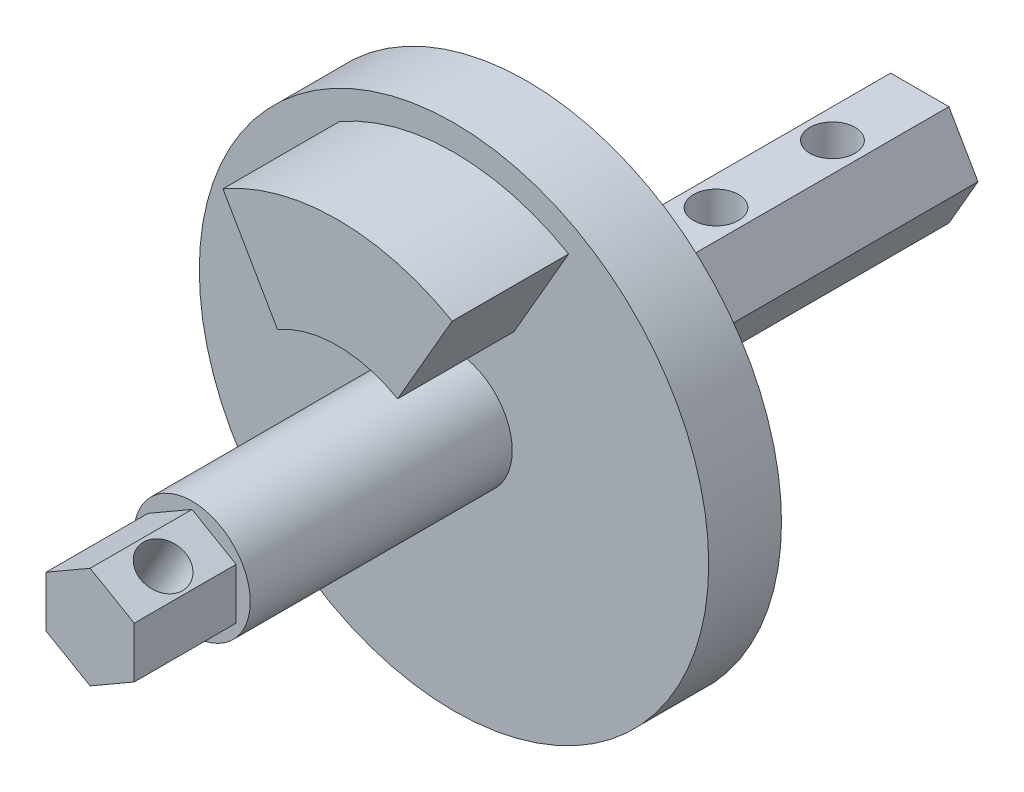
from build123d import *

# Parameters (mm, degrees)
SKETCH1_R           = 17.5
BOSS_EXTRUDE1_DEPTH = 2.5
BOSS_EXTRUDE2_DEPTH = 8
SKETCH3_R           = 4
BOSS_EXTRUDE3_DEPTH = 18
BOSS_EXTRUDE4_START = 7
SKETCH7_R           = 4
BOSS_EXTRUDE4_DEPTH = 7
BOSS_EXTRUDE5_DEPTH = 20
SKETCH10_R          = 1.55
CUT_EXTRUDE1_DEPTH  = 7
BOSS_EXTRUDE6_DEPTH = 7
SKETCH12_R          = 1.55
CUT_EXTRUDE2_DEPTH  = 6.1


with BuildPart() as part:
    # Sketch1 → Boss-Extrude1 (new, symmetric)
    with BuildSketch(Plane.XY):
        Circle(SKETCH1_R)
    extrude(amount=BOSS_EXTRUDE1_DEPTH, both=True)

    # Sketch2 → Boss-Extrude2 (add)
    with BuildSketch(Plane.XY.offset(2.5)):
        with BuildLine():
            Line((7.875, 13.63990011), (4.125, 7.144709581))
            ThreePointArc((4.125, 7.144709581), (0, 8.25), (-4.125, 7.144709581))
            Line((-4.125, 7.144709581), (-7.875, 13.63990011))
            ThreePointArc((-7.875, 13.63990011), (0, 15.75), (7.875, 13.63990011))
        make_face()
    extrude(amount=BOSS_EXTRUDE2_DEPTH)

    # Sketch3 → Boss-Extrude3 (add)
    with BuildSketch(Plane.XY.offset(2.5)):
        Circle(SKETCH3_R)
    extrude(amount=BOSS_EXTRUDE3_DEPTH)

    # Sketch7 → Boss-Extrude4 (add)
    with BuildSketch(Plane(origin=(0, 0, -2.5), x_dir=(-1, 0, 0), z_dir=(0, 0, -1)).offset(BOSS_EXTRUDE4_START)):
        with Locations(Location((0, 0, 0), (0, 0, 180))):
            Circle(SKETCH7_R)
    extrude(amount=-BOSS_EXTRUDE4_DEPTH)

    # Sketch9 → Boss-Extrude5 (add)
    with BuildSketch(Plane(origin=(0, 0, -9.5), x_dir=(-1, 0, 0), z_dir=(0, 0, -1))):
        Polygon((4, 0), (2, 3.464101615), (-2, 3.464101615), (-4, 0), (-2, -3.464101615), (2, -3.464101615), align=None)
    extrude(amount=BOSS_EXTRUDE5_DEPTH)

    # Sketch10 → Cut-Extrude1 (cut)
    with BuildSketch(Plane(origin=(0, -3.464101615, 0), x_dir=(-1, 0, 0), z_dir=(0, 1, 0))):
        with Locations(Location((0, -23.5, 0), (0, 0, 180))):
            Circle(SKETCH10_R)
        with Locations(Location((0, -15.5, 0), (0, 0, 180))):
            Circle(SKETCH10_R)
    extrude(amount=CUT_EXTRUDE1_DEPTH, mode=Mode.SUBTRACT)

    # Sketch11 → Boss-Extrude6 (add)
    with BuildSketch(Plane.XY.offset(20.5)):
        Polygon((3.031088913, 1.75), (0, 3.5), (-3.031088913, 1.75), (-3.031088913, -1.75), (0, -3.5), (3.031088913, -1.75), align=None)
    extrude(amount=BOSS_EXTRUDE6_DEPTH)

    # Sketch12 → Cut-Extrude2 (cut)
    with BuildSketch(Plane(origin=(-1.515544457, -2.625, 0), x_dir=(0.8660254037844372, -0.5000000000000026, 0), z_dir=(-0.5000000000000026, -0.8660254037844372, 0))):
        with Locations((0, 24)):
            Circle(SKETCH12_R)
    extrude(amount=-CUT_EXTRUDE2_DEPTH, mode=Mode.SUBTRACT)


solid = part.part
